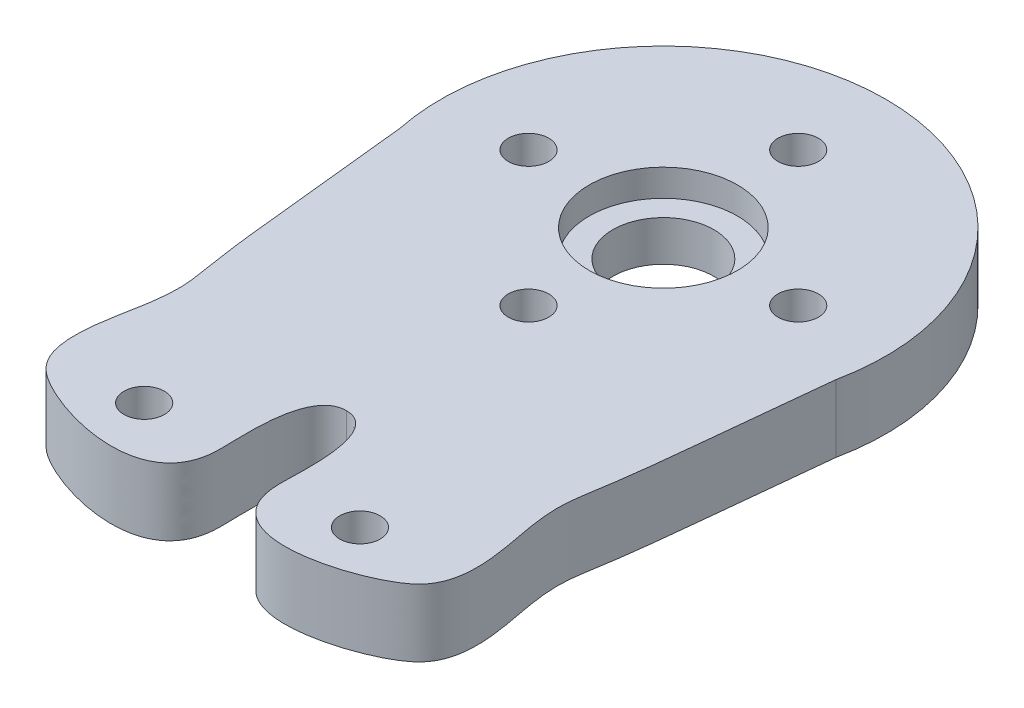
from build123d import *

# Parameters (mm, degrees)
CROQUIS1_R              = 16.5
CROQUIS1_R_2            = 3.75
CROQUIS1_R_3            = 1.5
SALIENTE_EXTRUIR1_DEPTH = 5
CROQUIS2_R              = 5.5
CORTAR_EXTRUIR1_DEPTH   = 2
CORTAR_EXTRUIR2_START   = -5
CROQUIS4_R              = 3
CORTAR_EXTRUIR2_DEPTH   = 2.5
CROQUIS6_R              = 1.5
SALIENTE_EXTRUIR3_DEPTH = 5


with BuildPart() as part:
    # Croquis1 → Saliente-Extruir1 (new body)
    with BuildSketch(Plane(origin=(0, 0, 0), x_dir=(1, 0, 0), z_dir=(0, 1, 0))):
        with Locations(Location((0, 0, 0), (0, 0, 270))):
            Circle(CROQUIS1_R)
        with Locations(Location((0, 0, 0), (0, 0, 270))):
            Circle(CROQUIS1_R_2, mode=Mode.SUBTRACT)
        with Locations(Location((10, 0, 0), (0, 0, 270))):
            Circle(CROQUIS1_R_3, mode=Mode.SUBTRACT)
        with Locations(Location((0, -10, 0), (0, 0, 270))):
            Circle(CROQUIS1_R_3, mode=Mode.SUBTRACT)
        with Locations(Location((-10, 0, 0), (0, 0, 270))):
            Circle(CROQUIS1_R_3, mode=Mode.SUBTRACT)
        with Locations(Location((0, 10, 0), (0, 0, 270))):
            Circle(CROQUIS1_R_3, mode=Mode.SUBTRACT)
    extrude(amount=SALIENTE_EXTRUIR1_DEPTH)

    # Croquis2 → Cortar-Extruir1 (cut)
    with BuildSketch(Plane(origin=(0, 5, 0), x_dir=(1, 0, 0), z_dir=(0, 1, 0))):
        with Locations(Location((0, 0, 0), (0, 0, 270))):
            Circle(CROQUIS2_R)
    extrude(amount=-CORTAR_EXTRUIR1_DEPTH, mode=Mode.SUBTRACT)

    # Croquis4 → Cortar-Extruir2 (cut)
    with BuildSketch(Plane(origin=(0, 5, 0), x_dir=(1, 0, 0), z_dir=(0, 1, 0)).offset(CORTAR_EXTRUIR2_START)):
        with Locations(Location((10, 0, 0), (0, 0, 270))):
            Circle(CROQUIS4_R)
        with Locations(Location((-10, 0, 0), (0, 0, 270))):
            Circle(CROQUIS4_R)
        with Locations(Location((0, 10, 0), (0, 0, 270))):
            Circle(CROQUIS4_R)
    extrude(amount=CORTAR_EXTRUIR2_DEPTH, mode=Mode.SUBTRACT)

    # Croquis6 → Saliente-Extruir3 (add)
    with BuildSketch(Plane(origin=(0, 5, 0), x_dir=(1, 0, 0), z_dir=(0, 1, 0))):
        with BuildLine():
            Line((-16.499999253, -0.004966275), (0, -15.162135144))
            Line((0, -15.162135144), (16.499999253, -0.004966275))
            add(Edge.make_bspline(
                [(16.499999253, -0.004966275), (14.789720677, -16.601874141), (14.779811161, -16.438973164), (14.200732618, -20.551745369), (13.635520661, -22.485602375), (15.733267293, -30.419610193), (11.37636727, -34.073606125), (1.56418736, -36.497980996), (2.416281914, -27.975905143), (1.888822796, -23.5), (0, -23.5)],
                knots=[0, 0, 0, 0, 0.196162037, 0.24321543, 0.470533934, 0.661030556, 0.708413553, 0.918147195, 0.949927511, 1, 1, 1, 1], degree=3))
            add(Edge.make_bspline(
                [(-16.499999253, -0.004966275), (-14.789720677, -16.601874141), (-14.779811161, -16.438973164), (-14.200732618, -20.551745369), (-13.635520661, -22.485602375), (-15.733267293, -30.419610193), (-11.37636727, -34.073606125), (-1.56418736, -36.497980996), (-2.416281914, -27.975905143), (-1.888822796, -23.5), (0, -23.5)],
                knots=[0, 0, 0, 0, 0.196162037, 0.24321543, 0.470533934, 0.661030556, 0.708413553, 0.918147195, 0.949927511, 1, 1, 1, 1], degree=3))
        make_face()
        with Locations(Location((-8, -30.5, 0), (0, 0, 270))):
            Circle(CROQUIS6_R, mode=Mode.SUBTRACT)
        with Locations(Location((8, -30.5, 0), (0, 0, 90))):
            Circle(CROQUIS6_R, mode=Mode.SUBTRACT)
    extrude(amount=-SALIENTE_EXTRUIR3_DEPTH)


solid = part.part
